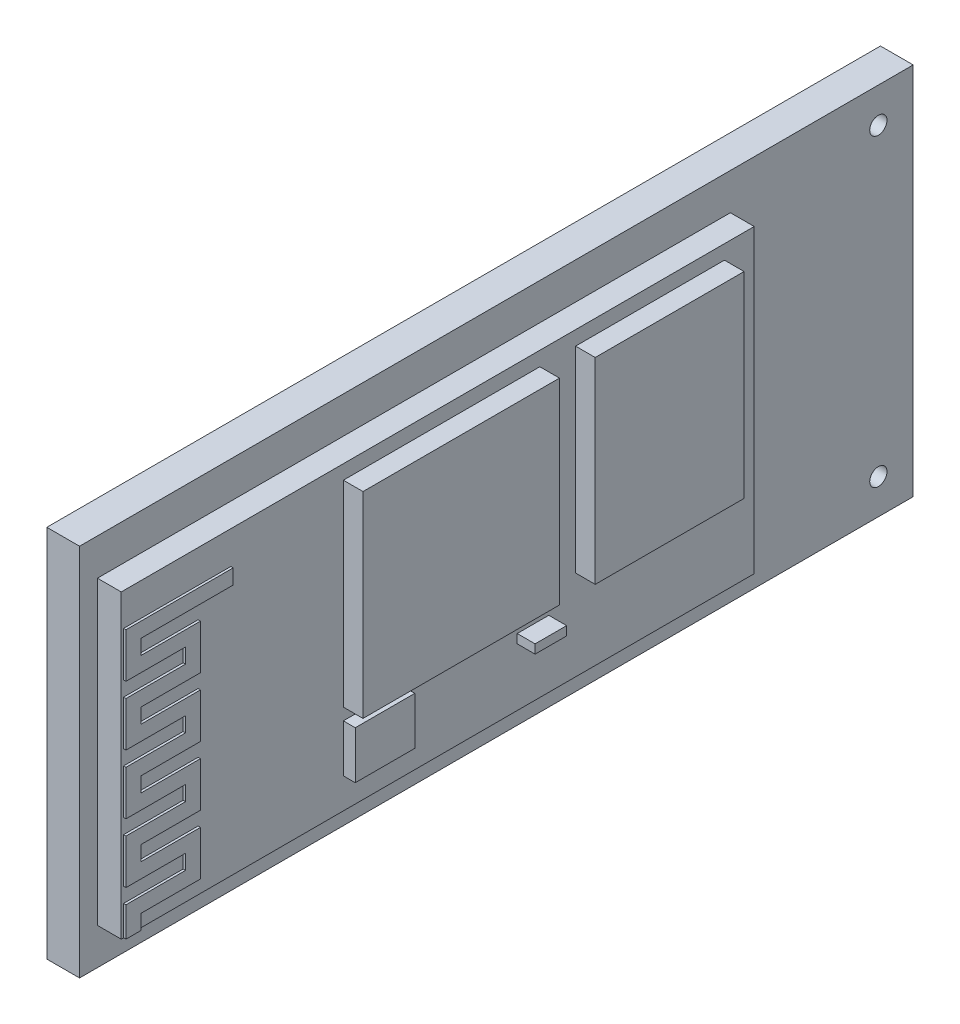
from build123d import *

# Parameters (mm, degrees)
SKETCH1_W            = 35.56
SKETCH1_H            = 15.9512
BOSS_EXTRUDE1_DEPTH  = 1.397
SKETCH14_W           = 27.0002
SKETCH14_H           = 12.827
BOSS_EXTRUDE14_DEPTH = 1.016
SKETCH15_W           = 4.572
SKETCH15_H           = 11.43
BOSS_EXTRUDE15_DEPTH = 0.1016
SKETCH16_W           = 0.1016
SKETCH16_H           = 10.795
CUT_EXTRUDE1_DEPTH   = 3.937
SKETCH17_W           = 2.54
SKETCH17_H           = 9.525
BOSS_EXTRUDE16_DEPTH = 0.1016
SKETCH18_W           = 2.54
SKETCH18_H           = 3.175
CUT_EXTRUDE2_DEPTH   = 0.1016
SKETCH19_W           = 2.54
SKETCH19_H           = 1.905
BOSS_EXTRUDE17_DEPTH = 0.1016
SKETCH20_W           = 2.54
SKETCH20_H           = 0.635
CUT_EXTRUDE3_DEPTH   = 0.1016
SKETCH21_W           = 2.54
SKETCH21_H           = 0.635
CUT_EXTRUDE4_DEPTH   = 0.1016
SKETCH22_W           = 2.54
SKETCH22_H           = 3.175
CUT_EXTRUDE5_DEPTH   = 0.1016
SKETCH23_W           = 2.54
SKETCH23_H           = 1.905
BOSS_EXTRUDE18_DEPTH = 0.1016
SKETCH24_W           = 2.54
SKETCH24_H           = 0.635
CUT_EXTRUDE6_DEPTH   = 0.1016
SKETCH25_W           = 1.3462
SKETCH25_H           = 0.381
BOSS_EXTRUDE19_DEPTH = 0.762
SKETCH26_W           = 6.35
SKETCH26_H           = 8.382
BOSS_EXTRUDE20_DEPTH = 0.8382
SKETCH27_W           = 8.382
SKETCH27_H           = 8.382
BOSS_EXTRUDE21_DEPTH = 0.8382
SKETCH28_W           = 2.54
SKETCH28_H           = 2.032
BOSS_EXTRUDE22_DEPTH = 0.508
HOLE1_D              = 0.7366
HOLE1_DEPTH          = 3.2512


with BuildPart() as part:
    # Sketch1 → Boss-Extrude1 (new body)
    with BuildSketch(Plane(origin=(-73.738355388, 0, 0), x_dir=(0, 0, -1), z_dir=(1, 0, 0))):
        with Locations((-23.5966, 48.047439016)):
            Rectangle(SKETCH1_W, SKETCH1_H)
    extrude(amount=-BOSS_EXTRUDE1_DEPTH)

    # Sketch14 → Boss-Extrude14 (add)
    with BuildSketch(Plane(origin=(-73.738355388, 0, 0), x_dir=(0, 0, -1), z_dir=(1, 0, 0))):
        with Locations((-27.1145, 48.047439016)):
            Rectangle(SKETCH14_W, SKETCH14_H)
    extrude(amount=BOSS_EXTRUDE14_DEPTH)

    # Sketch15 → Boss-Extrude15 (add)
    with BuildSketch(Plane(origin=(-72.722355388, 0, 0), x_dir=(0, 0, -1), z_dir=(1, 0, 0))):
        with Locations((-38.227, 47.348939016)):
            Rectangle(SKETCH15_W, SKETCH15_H)
    extrude(amount=BOSS_EXTRUDE15_DEPTH)

    # Sketch16 → Cut-Extrude1 (cut)
    with BuildSketch(Plane(origin=(0, 0, 35.941), x_dir=(-1, 0, 0), z_dir=(0, 0, -1))):
        with Locations((72.671555388, 47.031439016)):
            Rectangle(SKETCH16_W, SKETCH16_H)
    extrude(amount=-CUT_EXTRUDE1_DEPTH, mode=Mode.SUBTRACT)

    # Sketch17 → Boss-Extrude16 (add)
    with BuildSketch(Plane(origin=(-72.722355388, 0, 0), x_dir=(0, 0, -1), z_dir=(1, 0, 0))):
        with Locations((-38.608, 47.031439016)):
            Rectangle(SKETCH17_W, SKETCH17_H)
    extrude(amount=BOSS_EXTRUDE16_DEPTH)

    # Sketch18 → Cut-Extrude2 (cut)
    with BuildSketch(Plane(origin=(-72.620755388, 0, 0), x_dir=(0, 0, -1), z_dir=(1, 0, 0))):
        with Locations((-39.243, 49.571439016)):
            Rectangle(SKETCH18_W, SKETCH18_H)
    extrude(amount=-CUT_EXTRUDE2_DEPTH, mode=Mode.SUBTRACT)

    # Sketch19 → Boss-Extrude17 (add)
    with BuildSketch(Plane(origin=(-72.722355388, 0, 0), x_dir=(0, 0, -1), z_dir=(1, 0, 0))):
        with Locations((-39.243, 49.571439016)):
            Rectangle(SKETCH19_W, SKETCH19_H)
    extrude(amount=BOSS_EXTRUDE17_DEPTH)

    # Sketch20 → Cut-Extrude3 (cut)
    with BuildSketch(Plane(origin=(-72.620755388, 0, 0), x_dir=(0, 0, -1), z_dir=(1, 0, 0))):
        with Locations((-38.608, 49.571439016)):
            Rectangle(SKETCH20_W, SKETCH20_H)
    extrude(amount=-CUT_EXTRUDE3_DEPTH, mode=Mode.SUBTRACT)

    # Sketch21 → Cut-Extrude4 (cut)
    with BuildSketch(Plane(origin=(-72.620755388, 0, 0), x_dir=(0, 0, -1), z_dir=(1, 0, 0))):
        with Locations((-38.608, 47.031439016)):
            Rectangle(SKETCH21_W, SKETCH21_H)
    extrude(amount=-CUT_EXTRUDE4_DEPTH, mode=Mode.SUBTRACT)

    # Sketch22 → Cut-Extrude5 (cut)
    with BuildSketch(Plane(origin=(-72.620755388, 0, 0), x_dir=(0, 0, -1), z_dir=(1, 0, 0))):
        with Locations((-39.243, 44.491439016)):
            Rectangle(SKETCH22_W, SKETCH22_H)
    extrude(amount=-CUT_EXTRUDE5_DEPTH, mode=Mode.SUBTRACT)

    # Sketch23 → Boss-Extrude18 (add)
    with BuildSketch(Plane(origin=(-72.722355388, 0, 0), x_dir=(0, 0, -1), z_dir=(1, 0, 0))):
        with Locations((-39.243, 44.491439016)):
            Rectangle(SKETCH23_W, SKETCH23_H)
    extrude(amount=BOSS_EXTRUDE18_DEPTH)

    # Sketch24 → Cut-Extrude6 (cut)
    with BuildSketch(Plane(origin=(-72.620755388, 0, 0), x_dir=(0, 0, -1), z_dir=(1, 0, 0))):
        with Locations((-38.608, 44.491439016)):
            Rectangle(SKETCH24_W, SKETCH24_H)
    extrude(amount=-CUT_EXTRUDE6_DEPTH, mode=Mode.SUBTRACT)

    # Sketch25 → Boss-Extrude19 (add)
    with BuildSketch(Plane(origin=(-72.722355388, 0, 0), x_dir=(0, 0, -1), z_dir=(1, 0, 0))):
        with Locations((-23.0505, 44.288239016)):
            Rectangle(SKETCH25_W, SKETCH25_H)
    extrude(amount=BOSS_EXTRUDE19_DEPTH)

    # Sketch26 → Boss-Extrude20 (add)
    with BuildSketch(Plane(origin=(-72.722355388, 0, 0), x_dir=(0, 0, -1), z_dir=(1, 0, 0))):
        with Locations((-18.0594, 49.660339016)):
            Rectangle(SKETCH26_W, SKETCH26_H)
    extrude(amount=BOSS_EXTRUDE20_DEPTH)

    # Sketch27 → Boss-Extrude21 (add)
    with BuildSketch(Plane(origin=(-72.722355388, 0, 0), x_dir=(0, 0, -1), z_dir=(1, 0, 0))):
        with Locations((-26.9494, 49.660339016)):
            Rectangle(SKETCH27_W, SKETCH27_H)
    extrude(amount=BOSS_EXTRUDE21_DEPTH)

    # Sketch28 → Boss-Extrude22 (add)
    with BuildSketch(Plane(origin=(-72.722355388, 0, 0), x_dir=(0, 0, -1), z_dir=(1, 0, 0))):
        with Locations((-29.8704, 43.945339016)):
            Rectangle(SKETCH28_W, SKETCH28_H)
    extrude(amount=BOSS_EXTRUDE22_DEPTH)

    # Hole1
    with Locations(Plane.ZY.offset(75.135355388)):
        with Locations((7.3025, 41.557739016), (7.3025, 54.537139016)):
            Hole(HOLE1_D / 2, depth=HOLE1_DEPTH)


solid = part.part
